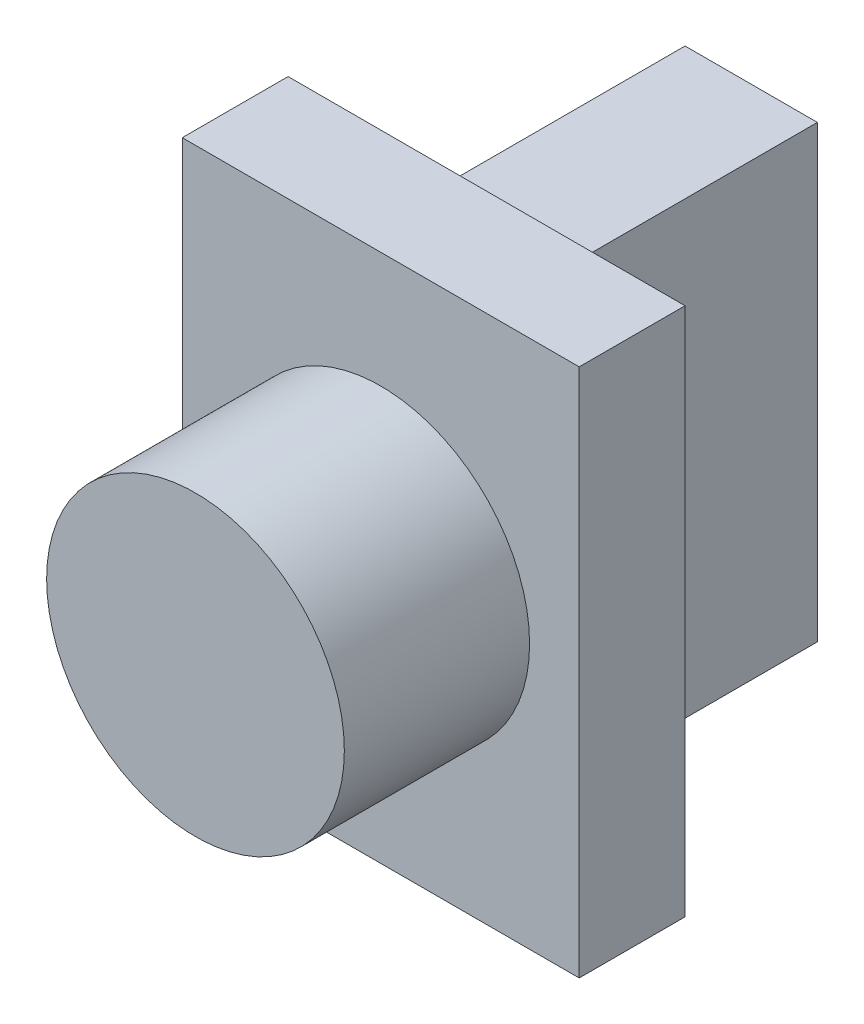
from build123d import *

# Parameters (mm, degrees)
ESQUISSE1_W          = 30
ESQUISSE1_H          = 40
BASE_EXTRUSION_DEPTH = 8
ESQUISSE2_W          = 10
ESQUISSE2_H          = 34
BOSS_EXTRU_1_DEPTH   = 20
ESQUISSE3_R          = 11.25
BOSS_EXTRU_2_DEPTH   = 14


with BuildPart() as part:
    # Esquisse1 → Base-Extrusion (new body)
    with BuildSketch(Plane.XY):
        Rectangle(ESQUISSE1_W, ESQUISSE1_H)
    extrude(amount=BASE_EXTRUSION_DEPTH)

    # Esquisse2 → Boss.-Extru.1 (add)
    with BuildSketch(Plane(origin=(0, 0, 0), x_dir=(-1, 0, 0), z_dir=(0, 0, -1))):
        Rectangle(ESQUISSE2_W, ESQUISSE2_H)
    extrude(amount=BOSS_EXTRU_1_DEPTH)

    # Esquisse3 → Boss.-Extru.2 (add)
    with BuildSketch(Plane.XY.offset(8)):
        Circle(ESQUISSE3_R)
    extrude(amount=BOSS_EXTRU_2_DEPTH)


solid = part.part
